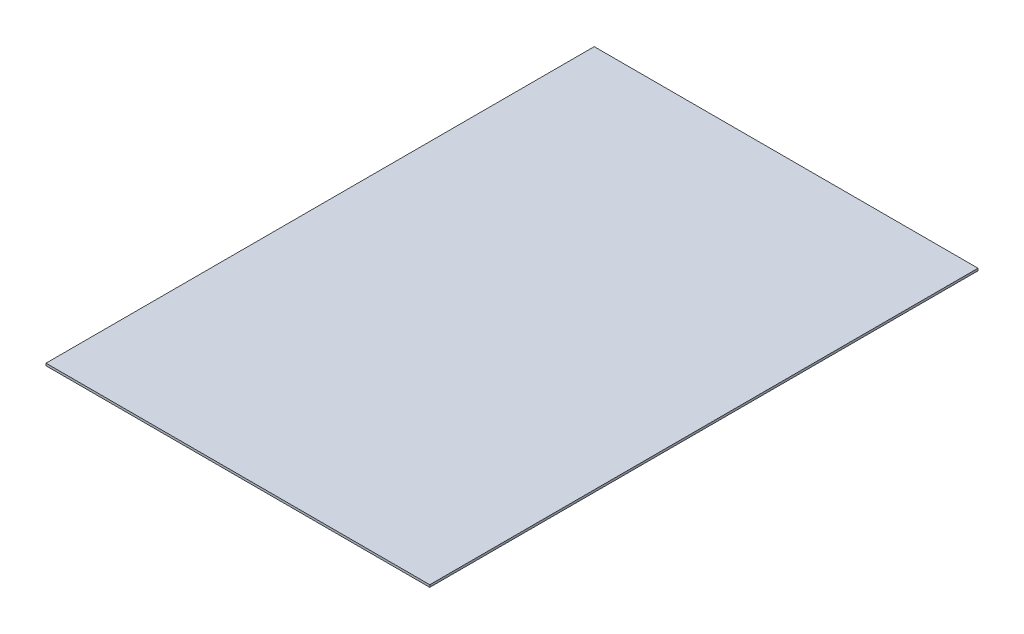
from build123d import *

# Parameters (mm, degrees)
BOSS_EXTRUDE1_DEPTH = 3.175


with BuildPart() as part:
    # Sketch1 → Boss-Extrude1 (new body)
    with BuildSketch(Plane(origin=(0, -25.4, 0), x_dir=(-1, 0, 0), z_dir=(0, -1, 0))):
        Polygon((-266.7, -381), (-266.7, 0), (-266.7, 381), (0, 381), (266.7, 381), (266.7, -381), (0, -381), align=None)
    extrude(amount=BOSS_EXTRUDE1_DEPTH)


solid = part.part
